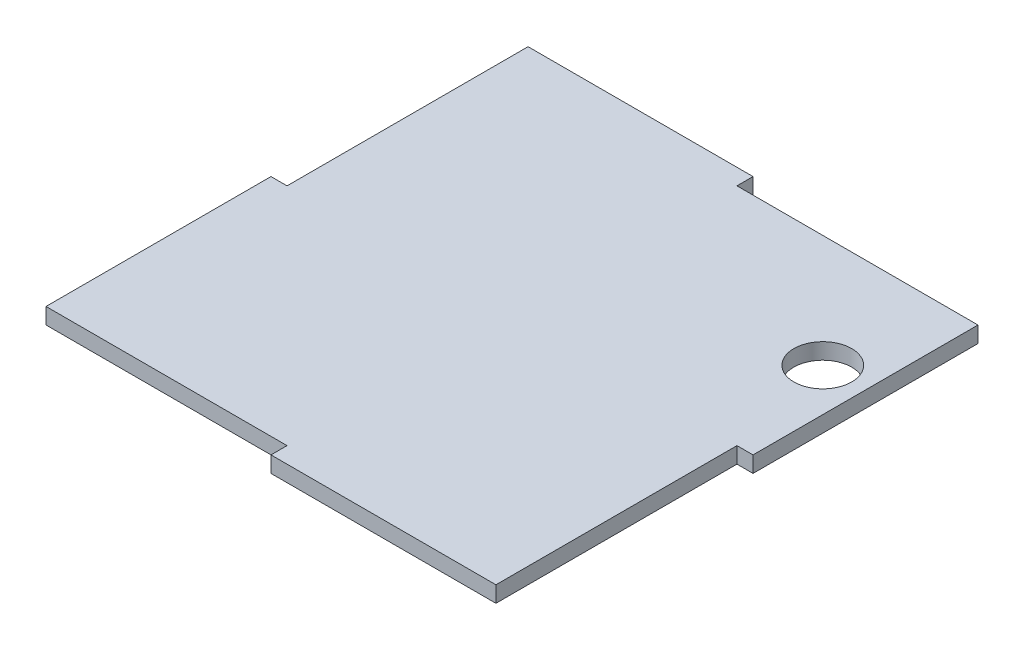
from build123d import *

# Parameters (mm, degrees)
SKETCH1_R           = 11.43
BOSS_EXTRUDE1_DEPTH = 6.35


with BuildPart() as part:
    # Sketch1 → Boss-Extrude1 (new body)
    with BuildSketch(Plane(origin=(0, 0, 0), x_dir=(1, 0, 0), z_dir=(0, 1, 0))):
        Polygon((-112.506214689, 99.790121605), (-112.506214689, 4.540121605), (-118.856214689, 4.540121605), (-118.856214689, -84.359878395), (-23.606214689, -84.359878395), (-23.606214689, -90.709878395), (65.293785311, -90.709878395), (65.293785311, 4.540121605), (71.643785311, 4.540121605), (71.643785311, 93.440121605), (-23.606214689, 93.440121605), (-23.606214689, 99.790121605), align=None)
        with Locations(Location((54.752785311, 48.990121605, 0), (0, 0, 270))):
            Circle(SKETCH1_R, mode=Mode.SUBTRACT)
    extrude(amount=BOSS_EXTRUDE1_DEPTH)


solid = part.part
